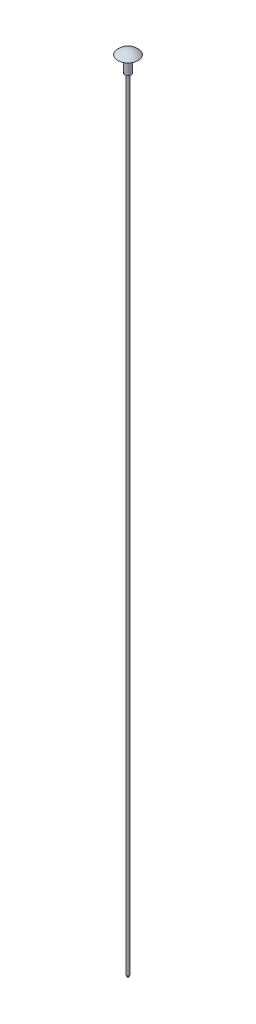
from build123d import *


with BuildPart() as part:
    # Sketch1 → Revolve1 (revolve)
    with BuildSketch(Plane.XY, mode=Mode.PRIVATE) as revolve1_sk:
        with BuildLine():
            Line((-5, 1300), (-5, -1291.339745962))
            Line((-5, -1291.339745962), (0, -1300))
            Line((0, -1300), (0, 1300))
            Line((0, 1300), (0, 1367.456844549))
            ThreePointArc((0, 1367.456844549), (-18.39217744, 1363.659264489), (-33.776137717, 1352.887654978))
            Line((-33.776137717, 1352.887654978), (-10.77842937, 1352.887654978))
            Line((-10.77842937, 1352.887654978), (-10.77842937, 1300))
            Line((-10.77842937, 1300), (-5, 1300))
        make_face()
    revolve(revolve1_sk.sketch.rotate(Axis((0, 1300, 0), (0, 1, 0)), 270), axis=Axis((0, 1300, 0), (0, 1, 0)))


solid = part.part
